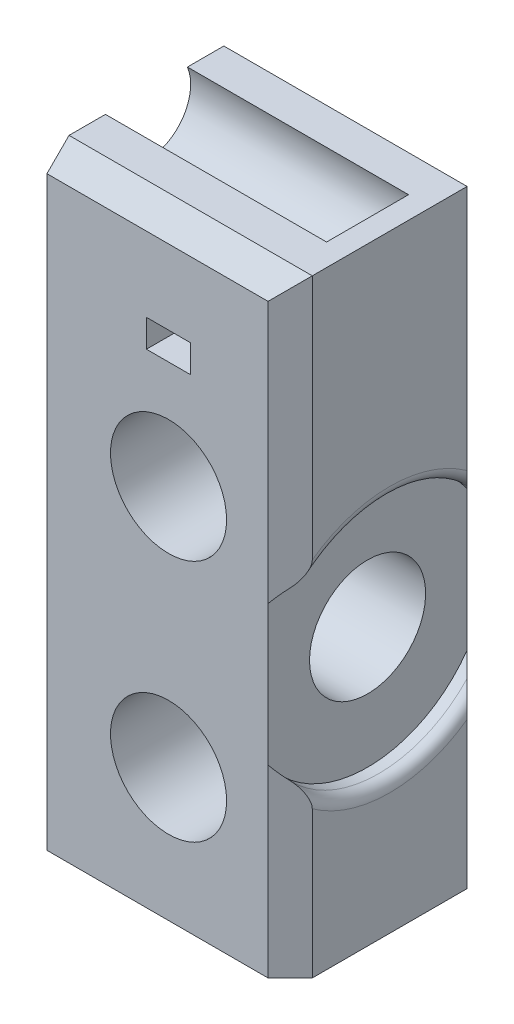
from build123d import *

# Parameters (mm, degrees)
SKETCH1_W           = 22
SKETCH1_H           = 55
SKETCH1_R           = 5.25
SKETCH1_W_2         = 4
SKETCH1_H_2         = 2.5
BOSS_EXTRUDE1_DEPTH = 18
SKETCH2_R           = 5.25
CUT_EXTRUDE1_DEPTH  = 62.911226769
SKETCH3_R           = 4
CUT_EXTRUDE2_DEPTH  = 20
CHAMFER1_SIZE       = 2
SKETCH4_R           = 11
CUT_EXTRUDE3_DEPTH  = 2
FILLET1_R           = 1
CHAMFER2_SIZE       = 2


with BuildPart() as part:
    # Sketch1 → Boss-Extrude1 (new body)
    with BuildSketch(Plane.XY):
        with Locations((11, 27.5)):
            Rectangle(SKETCH1_W, SKETCH1_H)
        with Locations((11, 12)):
            Circle(SKETCH1_R, mode=Mode.SUBTRACT)
        with Locations((11, 34)):
            Circle(SKETCH1_R, mode=Mode.SUBTRACT)
        with Locations((11, 45)):
            Rectangle(SKETCH1_W_2, SKETCH1_H_2, mode=Mode.SUBTRACT)
    extrude(amount=-BOSS_EXTRUDE1_DEPTH)

    # Sketch2 → Cut-Extrude1 (cut, through all)
    with BuildSketch(Plane.ZY):
        with Locations((-9, 23)):
            Circle(SKETCH2_R)
    extrude(amount=-CUT_EXTRUDE1_DEPTH, mode=Mode.SUBTRACT)

    # Sketch3 → Cut-Extrude2 (cut)
    with BuildSketch(Plane(origin=(0, 0, 0), x_dir=(0, 0, -1), z_dir=(1, 0, 0))):
        with Locations((9, 53.5)):
            Circle(SKETCH3_R)
    extrude(amount=CUT_EXTRUDE2_DEPTH, mode=Mode.SUBTRACT)

    # Chamfer1
    chamfer1_edges = [part.edges().sort_by_distance(p)[0] for p in [
        (22, 27.5, 0),
        (22, 27.5, -18),
    ]]
    chamfer(chamfer1_edges, length=CHAMFER1_SIZE)

    # Sketch4 → Cut-Extrude3 (cut)
    with BuildSketch(Plane(origin=(22, 0, 0), x_dir=(0, 0, -1), z_dir=(1, 0, 0))):
        with Locations((9, 23)):
            Circle(SKETCH4_R)
    extrude(amount=-CUT_EXTRUDE3_DEPTH, mode=Mode.SUBTRACT)

    # Fillet1
    fillet1_edges = [part.edges().sort_by_distance(p)[0] for p in [
        (22, 34, -9),
        (22, 12, -9),
    ]]
    fillet(fillet1_edges, radius=FILLET1_R)

    # Chamfer2
    chamfer2_edges = [part.edges().sort_by_distance(p)[0] for p in [
        (10, 55, 0),
        (10, 55, -18),
    ]]
    chamfer(chamfer2_edges, length=CHAMFER2_SIZE)


solid = part.part
